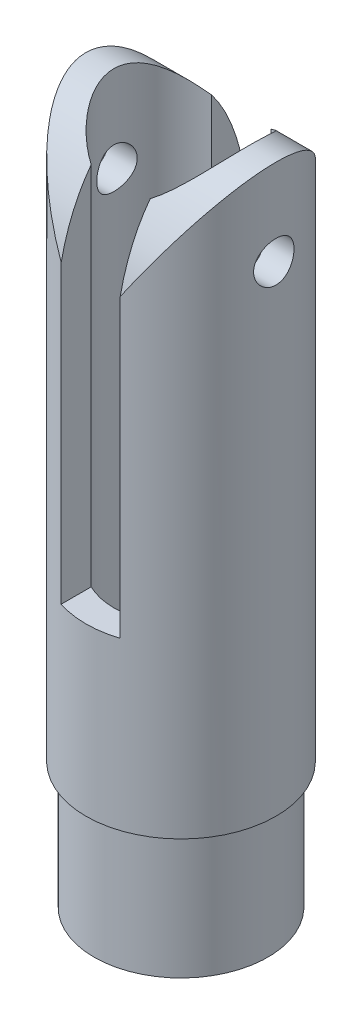
from build123d import *

# Parameters (mm, degrees)
SKETCH1_R               = 2.15
BOSS_EXTRUDE1_DEPTH     = 3.12
SKETCH2_R               = 2.35
BOSS_EXTRUDE2_DEPTH     = 14.2
SHELL1_T                = -0.69
CUT_EXTRUDE2_DEPTH      = 10
CUT_EXTRUDE2_DEPTH_BACK = 10
SKETCH9_W               = 1.46
SKETCH9_H               = 4.728587073
CUT_EXTRUDE3_DEPTH      = 10.08
CUT_EXTRUDE4_DEPTH      = 10.08
CUT_EXTRUDE4_DEPTH_BACK = 10.08
SKETCH11_R              = 0.5


with BuildPart() as part:
    # Sketch1 → Boss-Extrude1 (new body)
    with BuildSketch(Plane(origin=(0, 0, 0), x_dir=(1, 0, 0), z_dir=(0, 1, 0))):
        Circle(SKETCH1_R)
    extrude(amount=BOSS_EXTRUDE1_DEPTH)

    # Sketch2 → Boss-Extrude2 (add)
    with BuildSketch(Plane(origin=(0, 3.12, 0), x_dir=(1, 0, 0), z_dir=(0, 1, 0))):
        Circle(SKETCH2_R)
    extrude(amount=BOSS_EXTRUDE2_DEPTH)

    # Shell1
    shell1_openings = [part.faces().sort_by_distance(p)[0] for p in [
        (0, 17.32, 0),
        (0, 0, 0),
    ]]
    offset(amount=SHELL1_T, openings=shell1_openings, kind=Kind.INTERSECTION)

    # Sketch7 → Cut-Extrude2 (cut, two sides: drawn at the far end of the back side and taken through both)
    with BuildSketch(Plane(origin=(0, 0, 0), x_dir=(0, 0, -1), z_dir=(1, 0, 0)).offset(-CUT_EXTRUDE2_DEPTH_BACK)):
        with BuildLine():
            Line((-4.35, 13.399999995), (-2.35, 13.399999995))
            add(Edge.make_bspline(
                [(2.35, 13.399999995), (2.35, 17.133503588), (0, 17.133503588), (-2.35, 17.133503588), (-2.35, 13.399999995)],
                knots=[4.71238898, 4.71238898, 4.71238898, 6.283185307, 6.283185307, 7.853981634, 7.853981634, 7.853981634], degree=2, weights=[1, 0.707106781, 1, 0.707106781, 1]))
            Line((2.35, 13.399999995), (4.35, 13.399999995))
            add(Edge.make_bspline(
                [(4.35, 13.399999995), (4.35, 14.065444098), (4.192339822, 15.412663566), (3.474819887, 17.250199614), (2.38815107, 18.531514052), (1.114988399, 19.194360722), (0, 19.382819631), (-1.114988399, 19.194360722), (-2.38815107, 18.531514052), (-3.474819887, 17.250199614), (-4.192339822, 15.412663566), (-4.35, 14.065444098), (-4.35, 13.399999995)],
                knots=[-1.570796327, -1.570796327, -1.570796327, -1.570796327, -1.178097245, -0.785398163, -0.392699082, -0.196349541, 0, 0.196349541, 0.392699082, 0.785398163, 1.178097245, 1.570796327, 1.570796327, 1.570796327, 1.570796327], degree=3))
        make_face()
    extrude(amount=CUT_EXTRUDE2_DEPTH + CUT_EXTRUDE2_DEPTH_BACK, mode=Mode.SUBTRACT)

    # Sketch9 → Cut-Extrude3 (cut)
    with BuildSketch(Plane(origin=(0, 17.32, 0), x_dir=(-1, 0, 0), z_dir=(0, -1, 0))):
        with Locations((0, -0.000375881)):
            Rectangle(SKETCH9_W, SKETCH9_H)
    extrude(amount=CUT_EXTRUDE3_DEPTH, mode=Mode.SUBTRACT)

    # Sketch11 → Cut-Extrude4 (cut, two sides: drawn at the far end of the back side and taken through both)
    with BuildSketch(Plane(origin=(0, 0, 0), x_dir=(0, 0, -1), z_dir=(1, 0, 0)).offset(-CUT_EXTRUDE4_DEPTH_BACK)):
        with Locations((0, 15)):
            Circle(SKETCH11_R)
    extrude(amount=CUT_EXTRUDE4_DEPTH + CUT_EXTRUDE4_DEPTH_BACK, mode=Mode.SUBTRACT)


solid = part.part
